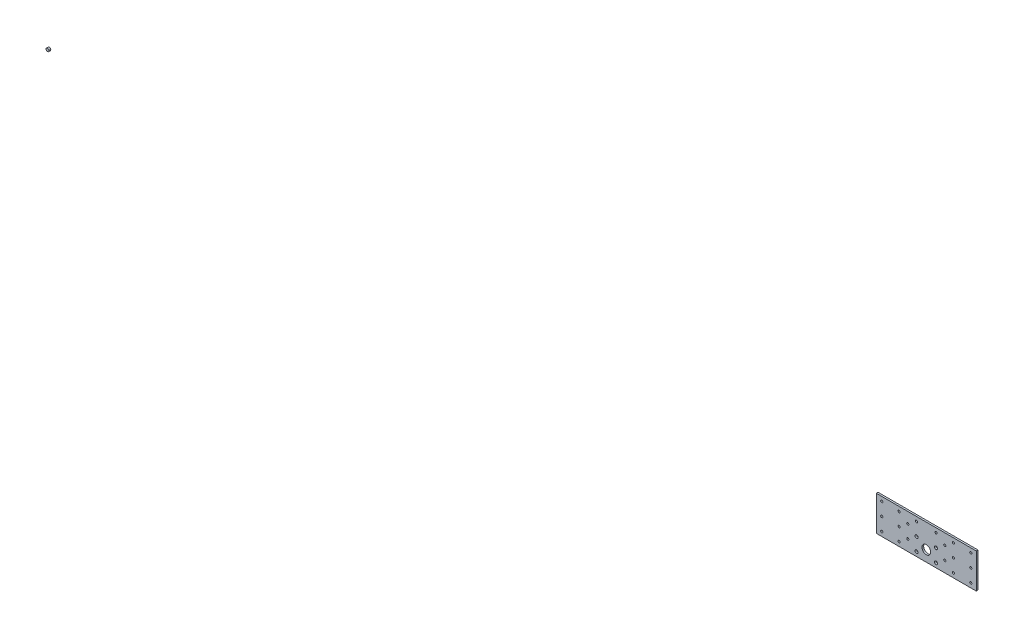
from build123d import *

# Parameters (mm, degrees)
ESQUISSE1_R          = 0.7
BOSS_EXTRU_1_DEPTH   = 0.8
ESQUISSE1_R_2        = 0.5
ESQUISSE1_R_3        = 2
BOSS_EXTRU_1_2_DEPTH = 0.8


with BuildPart() as part:
    # Esquisse1 → Boss.-Extru.1 (new body)
    with BuildSketch(Plane.XY):
        with Locations((-381.5, 2)):
            Circle(ESQUISSE1_R)
    extrude(amount=BOSS_EXTRU_1_DEPTH)


with BuildPart() as body_2:
    # Esquisse1 → Boss.-Extru.1 2 (new body)
    with BuildSketch(Plane.XY):
        Polygon((23, 0), (0, 0), (0, 16), (46, 16), (46, 0), align=None)
        with Locations((2.5, 8)):
            Circle(ESQUISSE1_R_2, mode=Mode.SUBTRACT)
        with Locations((2.5, 14)):
            Circle(ESQUISSE1_R_2, mode=Mode.SUBTRACT)
        with Locations((2.5, 2)):
            Circle(ESQUISSE1_R_2, mode=Mode.SUBTRACT)
        with Locations((10.5, 8)):
            Circle(ESQUISSE1_R_2, mode=Mode.SUBTRACT)
        with Locations((10.5, 2)):
            Circle(ESQUISSE1_R_2, mode=Mode.SUBTRACT)
        with Locations((10.5, 14)):
            Circle(ESQUISSE1_R_2, mode=Mode.SUBTRACT)
        with Locations((23, 5)):
            Circle(ESQUISSE1_R_3, mode=Mode.SUBTRACT)
        with Locations((18.5, 14)):
            Circle(ESQUISSE1_R_2, mode=Mode.SUBTRACT)
        with Locations((14.5, 5)):
            Circle(ESQUISSE1_R_2, mode=Mode.SUBTRACT)
        with Locations((14.5, 11)):
            Circle(ESQUISSE1_R_2, mode=Mode.SUBTRACT)
        with Locations((18.5, 2)):
            Circle(ESQUISSE1_R, mode=Mode.SUBTRACT)
        with Locations((18.5, 8)):
            Circle(ESQUISSE1_R, mode=Mode.SUBTRACT)
        with Locations(Location((27.5, 2, 0), (0, 0, 180))):
            Circle(ESQUISSE1_R, mode=Mode.SUBTRACT)
        with Locations(Location((31.5, 11, 0), (0, 0, 180))):
            Circle(ESQUISSE1_R_2, mode=Mode.SUBTRACT)
        with Locations(Location((31.5, 5, 0), (0, 0, 180))):
            Circle(ESQUISSE1_R_2, mode=Mode.SUBTRACT)
        with Locations(Location((27.5, 14, 0), (0, 0, 180))):
            Circle(ESQUISSE1_R_2, mode=Mode.SUBTRACT)
        with Locations(Location((35.5, 14, 0), (0, 0, 180))):
            Circle(ESQUISSE1_R_2, mode=Mode.SUBTRACT)
        with Locations(Location((35.5, 2, 0), (0, 0, 180))):
            Circle(ESQUISSE1_R_2, mode=Mode.SUBTRACT)
        with Locations(Location((35.5, 8, 0), (0, 0, 180))):
            Circle(ESQUISSE1_R_2, mode=Mode.SUBTRACT)
        with Locations(Location((43.5, 2, 0), (0, 0, 180))):
            Circle(ESQUISSE1_R_2, mode=Mode.SUBTRACT)
        with Locations(Location((43.5, 14, 0), (0, 0, 180))):
            Circle(ESQUISSE1_R_2, mode=Mode.SUBTRACT)
        with Locations(Location((43.5, 8, 0), (0, 0, 180))):
            Circle(ESQUISSE1_R_2, mode=Mode.SUBTRACT)
        with Locations(Location((27.5, 8, 0), (0, 0, 180))):
            Circle(ESQUISSE1_R, mode=Mode.SUBTRACT)
    extrude(amount=BOSS_EXTRU_1_2_DEPTH)


solid = Compound([part.part, body_2.part])
